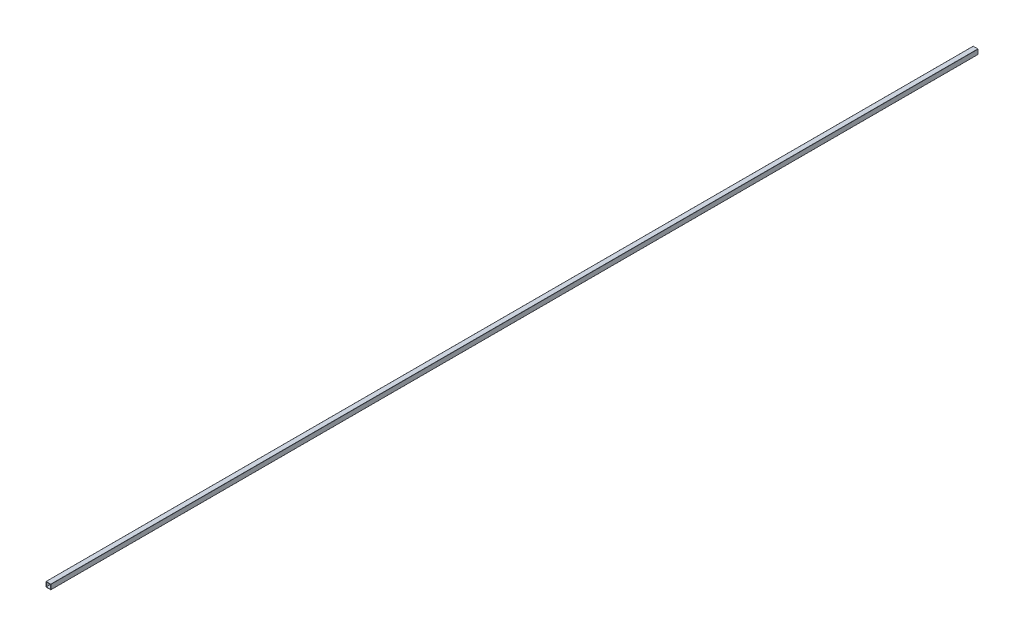
from build123d import *

# Parameters (mm, degrees)
CROQUIS1_W              = 27.92
CROQUIS1_H              = 27.92
SALIENTE_EXTRUIR1_DEPTH = 6000


with BuildPart() as part:
    # Croquis1 → Saliente-Extruir1 (new body)
    with BuildSketch(Plane.XY):
        with BuildLine():
            Line((-14.85, -15.85), (14.85, -15.85))
            ThreePointArc((14.85, -15.85), (15.557106781, -15.557106781), (15.85, -14.85))
            Line((15.85, -14.85), (15.85, 14.85))
            ThreePointArc((15.85, 14.85), (15.557106781, 15.557106781), (14.85, 15.85))
            Line((14.85, 15.85), (-14.85, 15.85))
            ThreePointArc((-14.85, 15.85), (-15.557106781, 15.557106781), (-15.85, 14.85))
            Line((-15.85, 14.85), (-15.85, -14.85))
            ThreePointArc((-15.85, -14.85), (-15.557106781, -15.557106781), (-14.85, -15.85))
        make_face()
        Rectangle(CROQUIS1_W, CROQUIS1_H, mode=Mode.SUBTRACT)
    extrude(amount=SALIENTE_EXTRUIR1_DEPTH)


solid = part.part
